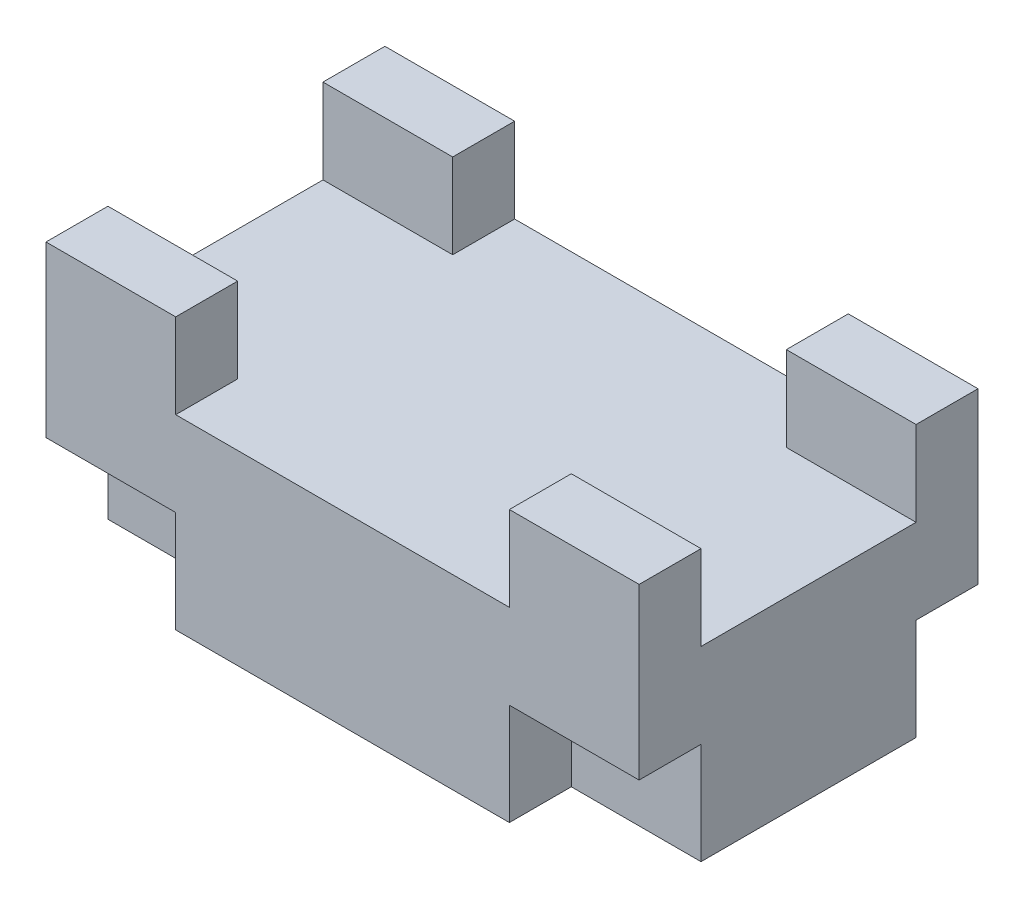
from build123d import *

# Parameters (mm, degrees)
BOSS_EXTRUDE1_DEPTH      = 55
BOSS_EXTRUDE2_DEPTH      = 25
BOSS_EXTRUDE2_DEPTH_BACK = 25
SKETCH3_W                = 38.273351984
SKETCH3_H                = 18.275853279


with BuildPart() as part:
    # Sketch1 → Boss-Extrude1 (new body)
    with BuildSketch(Plane(origin=(0, 0, 0), x_dir=(1, 0, 0), z_dir=(0, 1, 0))):
        Polygon((87.5, -31.724146721), (87.5, 31.724146721), (49.226648016, 31.724146721), (49.226648016, 50), (-49.226648016, 50), (-49.226648016, 31.724146721), (-87.5, 31.724146721), (-87.5, -31.724146721), (-49.226648016, -31.724146721), (-49.226648016, -50), (49.226648016, -50), (49.226648016, -31.724146721), align=None)
    extrude(amount=BOSS_EXTRUDE1_DEPTH)

    # Sketch3 → Boss-Extrude2 (add, two sides: drawn at the far end of the back side and taken through both)
    with BuildSketch(Plane(origin=(0, 55, 0), x_dir=(1, 0, 0), z_dir=(0, 1, 0)).offset(-BOSS_EXTRUDE2_DEPTH_BACK)):
        with Locations((-68.363324008, 40.86207336)):
            Rectangle(SKETCH3_W, SKETCH3_H)
        with Locations((-68.363324008, -40.86207336)):
            Rectangle(SKETCH3_W, SKETCH3_H)
        with Locations((68.363324008, -40.86207336)):
            Rectangle(SKETCH3_W, SKETCH3_H)
        with Locations((68.363324008, 40.86207336)):
            Rectangle(SKETCH3_W, SKETCH3_H)
    extrude(amount=BOSS_EXTRUDE2_DEPTH + BOSS_EXTRUDE2_DEPTH_BACK)


solid = part.part
